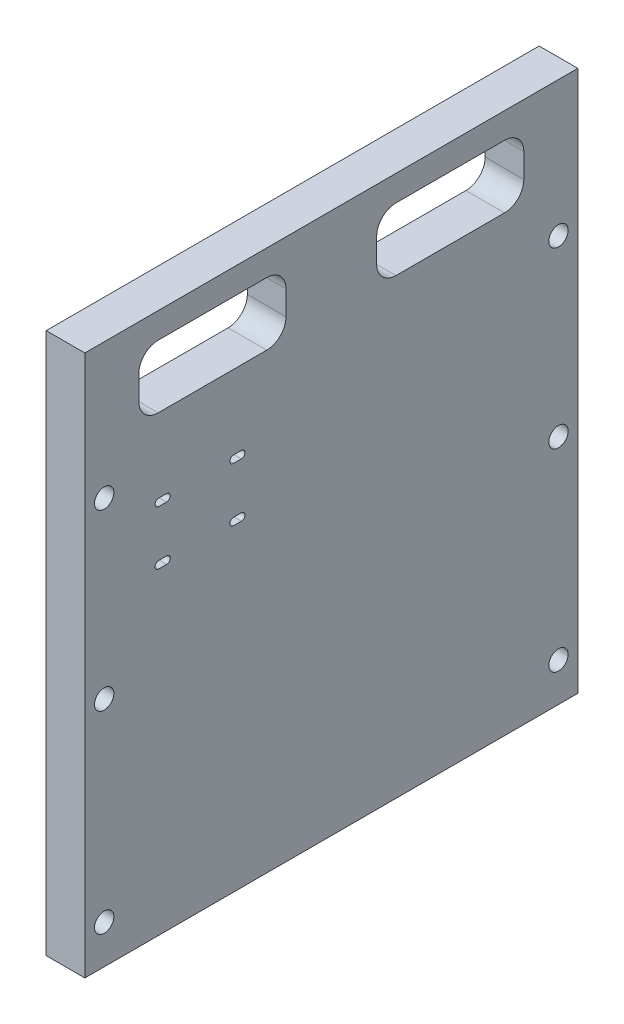
from build123d import *

# Parameters (mm, degrees)
SKETCH1_W           = 161.925
SKETCH1_H           = 177.8
SKETCH1_R           = 3.175
BOSS_EXTRUDE1_DEPTH = 12.7


with BuildPart() as part:
    # Sketch1 → Boss-Extrude1 (new body)
    with BuildSketch(Plane(origin=(0, 0, 0), x_dir=(0, 0, -1), z_dir=(1, 0, 0))):
        with Locations((20.6375, 12.7)):
            Rectangle(SKETCH1_W, SKETCH1_H)
        with BuildLine():
            ThreePointArc((5.747333697, 78.866901715), (3.887461758, 74.376773654), (-0.602666303, 72.516901715))
            Line((-0.602666303, 72.516901715), (-36.238896299, 72.516901715))
            ThreePointArc((-36.238896299, 72.516901715), (-40.729024359, 74.376773654), (-42.588896299, 78.866901715))
            Line((-42.588896299, 78.866901715), (-42.588896299, 86.823202123))
            ThreePointArc((-42.588896299, 86.823202123), (-40.729024359, 91.313330183), (-36.238896299, 93.173202123))
            Line((-36.238896299, 93.173202123), (-0.602666303, 93.173202123))
            ThreePointArc((-0.602666303, 93.173202123), (3.887461758, 91.313330183), (5.747333697, 86.823202123))
            Line((5.747333697, 86.823202123), (5.747333697, 78.866901715))
        make_face(mode=Mode.SUBTRACT)
        with BuildLine():
            ThreePointArc((83.863896299, 78.866901715), (82.004024359, 74.376773654), (77.513896299, 72.516901715))
            Line((77.513896299, 72.516901715), (41.877666303, 72.516901715))
            ThreePointArc((41.877666303, 72.516901715), (37.387538242, 74.376773654), (35.527666303, 78.866901715))
            Line((35.527666303, 78.866901715), (35.527666303, 86.823202123))
            ThreePointArc((35.527666303, 86.823202123), (37.387538242, 91.313330183), (41.877666303, 93.173202123))
            Line((41.877666303, 93.173202123), (77.513896299, 93.173202123))
            ThreePointArc((77.513896299, 93.173202123), (82.004024359, 91.313330183), (83.863896299, 86.823202123))
            Line((83.863896299, 86.823202123), (83.863896299, 78.866901715))
        make_face(mode=Mode.SUBTRACT)
        with Locations((95.25, 57.15)):
            Circle(SKETCH1_R, mode=Mode.SUBTRACT)
        with Locations((95.25, 0)):
            Circle(SKETCH1_R, mode=Mode.SUBTRACT)
        with Locations((-53.975, 57.15)):
            Circle(SKETCH1_R, mode=Mode.SUBTRACT)
        with Locations((-53.975, 0)):
            Circle(SKETCH1_R, mode=Mode.SUBTRACT)
        with BuildLine():
            Line((-36.055, 30.43), (-33.455, 30.43))
            ThreePointArc((-33.455, 30.43), (-32.255, 29.23), (-33.455, 28.03))
            Line((-33.455, 28.03), (-36.055, 28.03))
            ThreePointArc((-36.055, 28.03), (-37.255, 29.23), (-36.055, 30.43))
        make_face(mode=Mode.SUBTRACT)
        with BuildLine():
            Line((-36.055, 48.17), (-33.455, 48.17))
            ThreePointArc((-33.455, 48.17), (-32.255, 46.97), (-33.455, 45.77))
            Line((-33.455, 45.77), (-36.055, 45.77))
            ThreePointArc((-36.055, 45.77), (-37.255, 46.97), (-36.055, 48.17))
        make_face(mode=Mode.SUBTRACT)
        with Locations((95.25, -63.5)):
            Circle(SKETCH1_R, mode=Mode.SUBTRACT)
        with BuildLine():
            Line((-8.915, 28.03), (-11.515, 28.03))
            ThreePointArc((-11.515, 28.03), (-12.715, 29.23), (-11.515, 30.43))
            Line((-11.515, 30.43), (-8.915, 30.43))
            ThreePointArc((-8.915, 30.43), (-7.715, 29.23), (-8.915, 28.03))
        make_face(mode=Mode.SUBTRACT)
        with BuildLine():
            Line((-11.515, 48.17), (-8.915, 48.17))
            ThreePointArc((-8.915, 48.17), (-7.715, 46.97), (-8.915, 45.77))
            Line((-8.915, 45.77), (-11.515, 45.77))
            ThreePointArc((-11.515, 45.77), (-12.715, 46.97), (-11.515, 48.17))
        make_face(mode=Mode.SUBTRACT)
        with Locations((-53.975, -63.5)):
            Circle(SKETCH1_R, mode=Mode.SUBTRACT)
    extrude(amount=BOSS_EXTRUDE1_DEPTH)


solid = part.part
